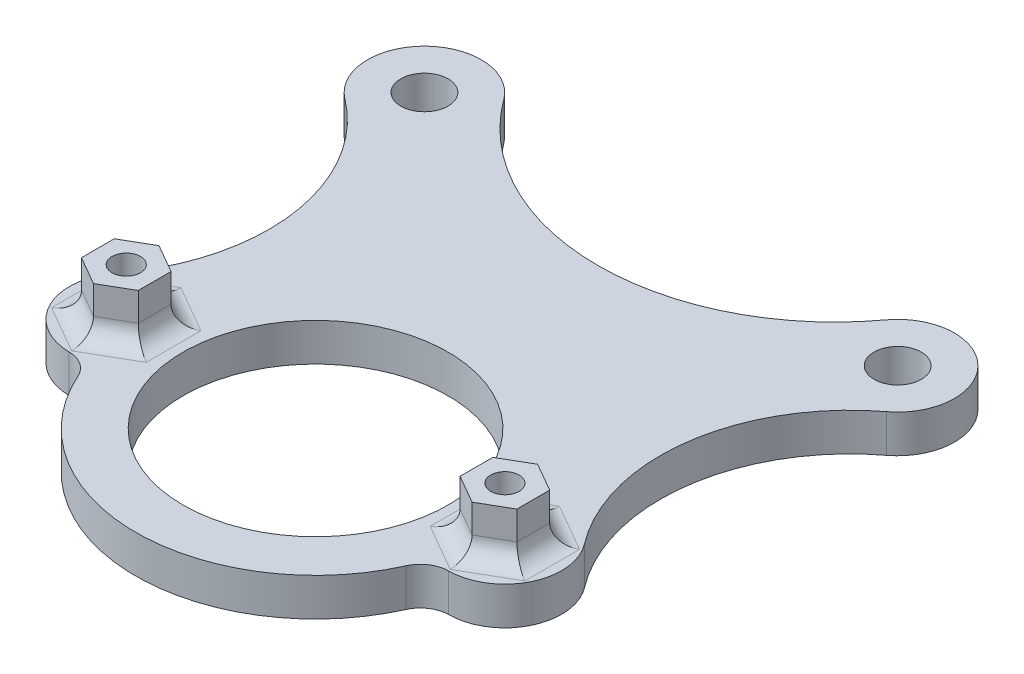
from build123d import *

# Parameters (mm, degrees)
SKETCH1_R           = 14
SKETCH1_R_2         = 2.5
BOSS_EXTRUDE1_DEPTH = 4
FILLET1_R           = 3
SKETCH2_R           = 1.5
CUT_EXTRUDE1_DEPTH  = 10
BOSS_EXTRUDE2_START = 5
SKETCH3_R           = 1.5
BOSS_EXTRUDE2_DEPTH = 5
FILLET2_R           = 2
BOSS_EXTRUDE3_DEPTH = 4


with BuildPart() as part:
    # Sketch1 → Boss-Extrude1 (new body)
    with BuildSketch(Plane(origin=(0, 0, 0), x_dir=(1, 0, 0), z_dir=(0, 1, 0))):
        with BuildLine():
            Line((8.126919667, 17.174200905), (19.588621549, 33.908285652))
            ThreePointArc((19.588621549, 33.908285652), (28.390534034, 41.45017969), (24.538801239, 30.517751618))
            Line((24.538801239, 30.517751618), (13.077099357, 13.783666871))
            ThreePointArc((13.077099357, 13.783666871), (16.116177061, 10.06324187), (18.125, 5.699506558))
            ThreePointArc((18.125, 5.699506558), (26, 0), (18.125, -5.699506558))
            ThreePointArc((18.125, -5.699506558), (11.240760103, -15.318136711), (0, -19))
            ThreePointArc((0, -19), (-11.240760103, -15.318136711), (-18.125, -5.699506558))
            ThreePointArc((-18.125, -5.699506558), (-26, 0), (-18.125, 5.699506558))
            ThreePointArc((-18.125, 5.699506558), (-16.116177061, 10.06324187), (-13.077099357, 13.783666871))
            Line((-13.077099357, 13.783666871), (-24.538801239, 30.517751618))
            ThreePointArc((-24.538801239, 30.517751618), (-28.390534034, 41.45017969), (-19.588621549, 33.908285652))
            Line((-19.588621549, 33.908285652), (-8.126919667, 17.174200905))
            ThreePointArc((-8.126919667, 17.174200905), (0, 19), (8.126919667, 17.174200905))
        make_face()
        with Locations(Location((0, 0, 0), (0, 0, 270))):
            Circle(SKETCH1_R, mode=Mode.SUBTRACT)
        with Locations(Location((25, 36.5, 0), (0, 0, 270))):
            Circle(SKETCH1_R_2, mode=Mode.SUBTRACT)
        with Locations(Location((-25, 36.5, 0), (0, 0, 90))):
            Circle(SKETCH1_R_2, mode=Mode.SUBTRACT)
    extrude(amount=BOSS_EXTRUDE1_DEPTH)

    # Fillet1
    fillet1_edges = [part.edges().sort_by_distance(p)[0] for p in [
        (8.126919667, 2, -17.174200905),
        (19.588621549, 2, -33.908285652),
        (24.538801239, 2, -30.517751618),
        (13.077099357, 2, -13.783666871),
        (18.125, 2, 5.699506558),
        (-18.125, 2, 5.699506558),
        (-18.125, 2, -5.699506558),
        (-13.077099357, 2, -13.783666871),
        (-24.538801239, 2, -30.517751618),
        (-19.588621549, 2, -33.908285652),
        (-8.126919667, 2, -17.174200905),
    ]]
    fillet(fillet1_edges, radius=FILLET1_R)

    # Sketch2 → Cut-Extrude1 (cut)
    with BuildSketch(Plane(origin=(0, 4, 0), x_dir=(1, 0, 0), z_dir=(0, 1, 0))):
        with Locations(Location((20, 0, 0), (0, 0, 270))):
            Circle(SKETCH2_R)
        with Locations(Location((-20, 0, 0), (0, 0, 90))):
            Circle(SKETCH2_R)
    extrude(amount=-CUT_EXTRUDE1_DEPTH, mode=Mode.SUBTRACT)

    # Sketch3 → Boss-Extrude2 (add)
    # profile 1 of 2: a face of its own
    with BuildSketch(Plane(origin=(0, 4, 0), x_dir=(1, 0, 0), z_dir=(0, 1, 0)).offset(BOSS_EXTRUDE2_START)):
        Polygon((-20, 3.464101615), (-23, 1.732050808), (-23, -1.732050808), (-20, -3.464101615), (-17, -1.732050808), (-17, 1.732050808), align=None)
        with Locations(Location((-20, 0, 0), (0, 0, 270))):
            Circle(SKETCH3_R, mode=Mode.SUBTRACT)
    # profile 2 of 2: a face of its own
    with BuildSketch(Plane(origin=(0, 4, 0), x_dir=(1, 0, 0), z_dir=(0, 1, 0)).offset(BOSS_EXTRUDE2_START)):
        Polygon((20, 3.464101615), (17, 1.732050808), (17, -1.732050808), (20, -3.464101615), (23, -1.732050808), (23, 1.732050808), align=None)
        with Locations(Location((20, 0, 0), (0, 0, 270))):
            Circle(SKETCH3_R, mode=Mode.SUBTRACT)
    extrude(amount=-BOSS_EXTRUDE2_DEPTH)

    # Fillet2
    fillet2_edges = [part.edges().sort_by_distance(p)[0] for p in [
        (-18.5, 4, -2.598076211),
        (-21.5, 4, -2.598076211),
        (-23, 4, 0),
        (-21.5, 4, 2.598076211),
        (-18.5, 4, 2.598076211),
        (-17, 4, 0),
        (21.5, 4, -2.598076211),
        (18.5, 4, -2.598076211),
        (17, 4, 0),
        (18.5, 4, 2.598076211),
        (21.5, 4, 2.598076211),
        (23, 4, 0),
    ]]
    fillet(fillet2_edges, radius=FILLET2_R)

    # Sketch4 → Boss-Extrude3 (add)
    with BuildSketch(Plane(origin=(0, 4, 0), x_dir=(1, 0, 0), z_dir=(0, 1, 0))):
        with BuildLine():
            ThreePointArc((24.772139191, 3.636851323), (20.864321919, 18.474065491), (28.618293037, 31.7137744))
            ThreePointArc((28.618293037, 31.7137744), (21.354403975, 32.800609697), (20.161290323, 40.047800538))
            ThreePointArc((20.161290323, 40.047800538), (0, 29.83030278), (-20.161290323, 40.047800538))
            ThreePointArc((-20.161290323, 40.047800538), (-21.354403975, 32.800609697), (-28.618293037, 31.7137744))
            ThreePointArc((-28.618293037, 31.7137744), (-20.864321919, 18.474065491), (-24.772139191, 3.636851323))
            ThreePointArc((-24.772139191, 3.636851323), (-19.807252921, 3.994836175), (-15.415783274, 6.338603052))
            ThreePointArc((-15.415783274, 6.338603052), (-9.04861994, 13.254364925), (0, 15.802110673))
            ThreePointArc((0, 15.802110673), (9.04861994, 13.254364925), (15.415783274, 6.338603052))
            ThreePointArc((15.415783274, 6.338603052), (19.807252921, 3.994836175), (24.772139191, 3.636851323))
        make_face()
    extrude(amount=-BOSS_EXTRUDE3_DEPTH)


solid = part.part
